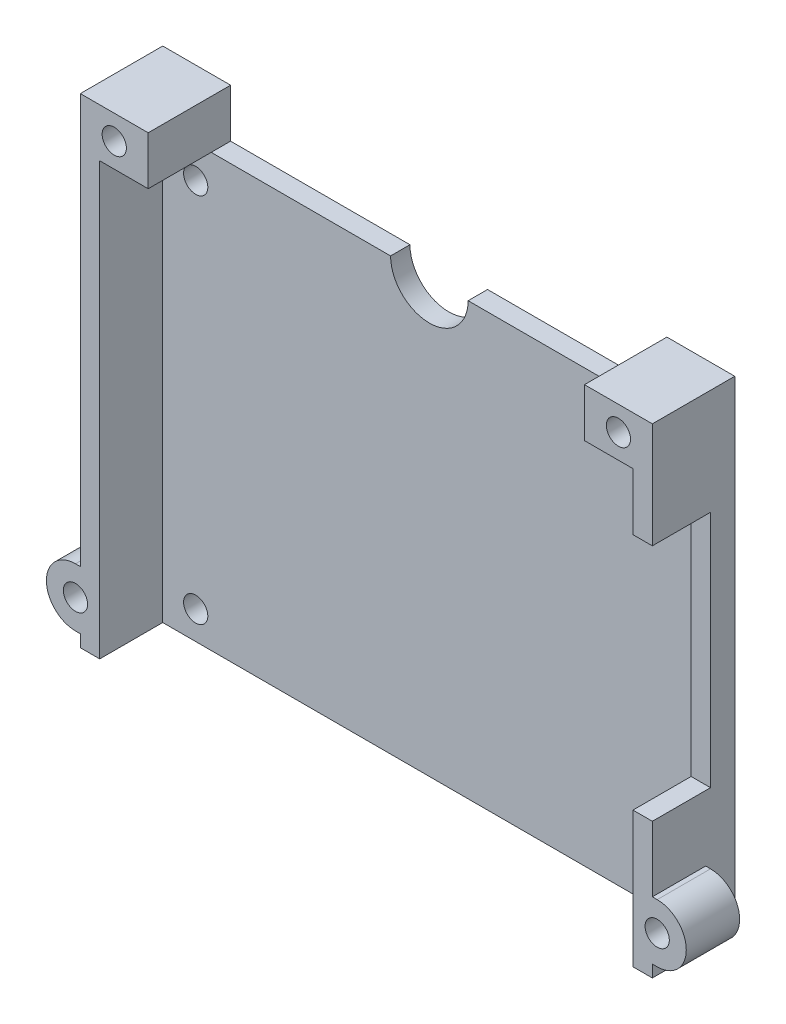
from build123d import *

# Parameters (mm, degrees)
BOSS_EXTRUDE1_DEPTH = 44.5
SKETCH2_W           = 6
SKETCH2_H           = 24.6
CUT_EXTRUDE1_DEPTH  = 10
BOSS_EXTRUDE2_DEPTH = 8.5
CUT_EXTRUDE2_DEPTH  = 11
SKETCH4_W           = 7
SKETCH4_H           = 8.5
BOSS_EXTRUDE3_DEPTH = 5
SKETCH5_R           = 1.25
CUT_EXTRUDE3_DEPTH  = 81.179486155
SKETCH7_R           = 1.25
CUT_EXTRUDE4_DEPTH  = 10
SKETCH8_R           = 4
CUT_EXTRUDE5_DEPTH  = 81.179486155
CUT_EXTRUDE6_DEPTH  = 3
BOSS_EXTRUDE4_DEPTH = 3


with BuildPart() as part:
    # Sketch1 → Boss-Extrude1 (new body)
    with BuildSketch(Plane(origin=(0, 0, 0), x_dir=(1, 0, 0), z_dir=(0, 1, 0))):
        Polygon((0, 0), (2, 0), (2, 6.5), (57, 6.5), (57, 0), (59, 0), (59, 8.5), (0, 8.5), align=None)
    extrude(amount=BOSS_EXTRUDE1_DEPTH)

    # Sketch2 → Cut-Extrude1 (cut)
    with BuildSketch(Plane(origin=(59, 0, 0), x_dir=(0, 0, -1), z_dir=(1, 0, 0))):
        with Locations((3, 26.3)):
            Rectangle(SKETCH2_W, SKETCH2_H)
    extrude(amount=-CUT_EXTRUDE1_DEPTH, mode=Mode.SUBTRACT)

    # Sketch3 → Boss-Extrude2 (add)
    with BuildSketch(Plane(origin=(0, 0, -8.5), x_dir=(-1, 0, 0), z_dir=(0, 0, -1))):
        with BuildLine():
            Line((-59, 5.395643924), (-59, 7.25))
            Line((-59, 7.25), (-59.5, 7.25))
            ThreePointArc((-59.5, 7.25), (-62.5, 4.25), (-59.5, 1.25))
            Line((-59.5, 1.25), (-59, 1.25))
            Line((-59, 1.25), (-59, 3.104356076))
            ThreePointArc((-59, 3.104356076), (-60.75, 4.25), (-59, 5.395643924))
        make_face()
        with BuildLine():
            Line((0.5, 7.25), (0, 7.25))
            Line((0, 7.25), (0, 5.395643924))
            ThreePointArc((0, 5.395643924), (1.75, 4.25), (0, 3.104356076))
            Line((0, 3.104356076), (0, 1.25))
            Line((0, 1.25), (0.5, 1.25))
            ThreePointArc((0.5, 1.25), (3.5, 4.25), (0.5, 7.25))
        make_face()
    extrude(amount=-BOSS_EXTRUDE2_DEPTH)

    # Sketch3<3> → Cut-Extrude2 (cut)
    with BuildSketch(Plane(origin=(0, 0, -8.5), x_dir=(-1, 0, 0), z_dir=(0, 0, -1))):
        with BuildLine():
            ThreePointArc((-59, 3.104356076), (-58.25, 4.25), (-59, 5.395643924))
            Line((-59, 5.395643924), (-59, 3.104356076))
        make_face()
        with BuildLine():
            Line((0, 3.104356076), (0, 5.395643924))
            ThreePointArc((0, 5.395643924), (-0.75, 4.25), (0, 3.104356076))
        make_face()
    extrude(amount=-CUT_EXTRUDE2_DEPTH, mode=Mode.SUBTRACT)

    # Sketch4 → Boss-Extrude3 (add)
    with BuildSketch(Plane(origin=(0, 44.5, 0), x_dir=(1, 0, 0), z_dir=(0, 1, 0))):
        with Locations((3.5, 4.25)):
            Rectangle(SKETCH4_W, SKETCH4_H)
        with Locations((55.5, 4.25)):
            Rectangle(SKETCH4_W, SKETCH4_H)
    extrude(amount=BOSS_EXTRUDE3_DEPTH)

    # Sketch5 → Cut-Extrude3 (cut, through all)
    with BuildSketch(Plane(origin=(0, 0, -8.5), x_dir=(-1, 0, 0), z_dir=(0, 0, -1))):
        with Locations((-55.5, 47)):
            Circle(SKETCH5_R)
        with Locations((-3.5, 47)):
            Circle(SKETCH5_R)
    extrude(amount=-CUT_EXTRUDE3_DEPTH, mode=Mode.SUBTRACT)

    # Sketch7 → Cut-Extrude4 (cut)
    with BuildSketch(Plane(origin=(0, 0, -8.5), x_dir=(-1, 0, 0), z_dir=(0, 0, -1))):
        with Locations((-5.4, 2.9)):
            Circle(SKETCH7_R)
        with Locations((-53.6, 2.9)):
            Circle(SKETCH7_R)
        with Locations((-53.6, 41.2)):
            Circle(SKETCH7_R)
        with Locations((-5.4, 41.2)):
            Circle(SKETCH7_R)
    extrude(amount=-CUT_EXTRUDE4_DEPTH, mode=Mode.SUBTRACT)

    # Sketch8 → Cut-Extrude5 (cut, through all)
    with BuildSketch(Plane(origin=(0, 0, -8.5), x_dir=(-1, 0, 0), z_dir=(0, 0, -1))):
        with Locations((-29.5, 44.5)):
            Circle(SKETCH8_R)
    extrude(amount=-CUT_EXTRUDE5_DEPTH, mode=Mode.SUBTRACT)

    # Sketch3<4> → Cut-Extrude6 (cut)
    with BuildSketch(Plane(origin=(0, 0, -8.5), x_dir=(-1, 0, 0), z_dir=(0, 0, -1))):
        with BuildLine():
            Line((-59, 5.395643924), (-59, 7.25))
            Line((-59, 7.25), (-59.5, 7.25))
            ThreePointArc((-59.5, 7.25), (-62.5, 4.25), (-59.5, 1.25))
            Line((-59.5, 1.25), (-59, 1.25))
            Line((-59, 1.25), (-59, 3.104356076))
            ThreePointArc((-59, 3.104356076), (-60.75, 4.25), (-59, 5.395643924))
        make_face()
        with BuildLine():
            Line((0.5, 7.25), (0, 7.25))
            Line((0, 7.25), (0, 5.395643924))
            ThreePointArc((0, 5.395643924), (1.75, 4.25), (0, 3.104356076))
            Line((0, 3.104356076), (0, 1.25))
            Line((0, 1.25), (0.5, 1.25))
            ThreePointArc((0.5, 1.25), (3.5, 4.25), (0.5, 7.25))
        make_face()
    extrude(amount=-CUT_EXTRUDE6_DEPTH, mode=Mode.SUBTRACT)

    # Sketch3<5> → Boss-Extrude4 (add)
    with BuildSketch(Plane(origin=(0, 0, -8.5), x_dir=(-1, 0, 0), z_dir=(0, 0, -1))):
        with BuildLine():
            ThreePointArc((-59, 3.104356076), (-58.25, 4.25), (-59, 5.395643924))
            Line((-59, 5.395643924), (-59, 3.104356076))
        make_face()
        with BuildLine():
            Line((0, 3.104356076), (0, 5.395643924))
            ThreePointArc((0, 5.395643924), (-0.75, 4.25), (0, 3.104356076))
        make_face()
    extrude(amount=-BOSS_EXTRUDE4_DEPTH)


solid = part.part
